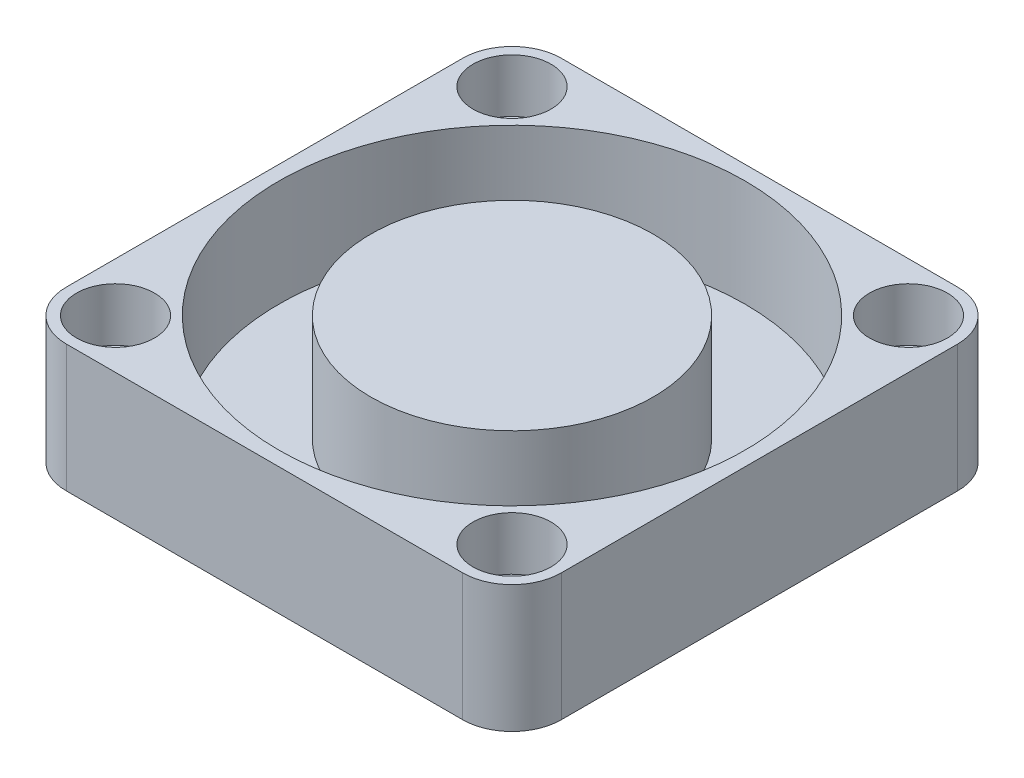
from build123d import *

# Parameters (mm, degrees)
SKETCH1_W            = 30.15
SKETCH1_H            = 30.15
BOSS_EXTRUDE1_DEPTH  = 7.75
FILLET1_R            = 3
M3_CLEARANCE_HOLE1_D = 3.2
SKETCH4_R            = 2.375
CUT_EXTRUDE1_DEPTH   = 3.25
SKETCH5_R            = 14.2
SKETCH5_R_2          = 8.6
CUT_EXTRUDE2_DEPTH   = 6.5


with BuildPart() as part:
    # Sketch1 → Boss-Extrude1 (new body)
    with BuildSketch(Plane(origin=(0, 0, 0), x_dir=(1, 0, 0), z_dir=(0, 1, 0))):
        Rectangle(SKETCH1_W, SKETCH1_H)
    extrude(amount=BOSS_EXTRUDE1_DEPTH)

    # Fillet1
    fillet1_edges = [part.edges().sort_by_distance(p)[0] for p in [
        (15.075, 3.875, 15.075),
        (-15.075, 3.875, 15.075),
        (-15.075, 3.875, -15.075),
        (15.075, 3.875, -15.075),
    ]]
    fillet(fillet1_edges, radius=FILLET1_R)

    # M3 Clearance Hole1 (through all)
    with Locations(Plane(origin=(0, 7.75, 0), x_dir=(1, 0, 0), z_dir=(0, 1, 0))):
        with Locations((-12.075, 12.075), (12.075, 12.075), (12.075, -12.075), (-12.075, -12.075)):
            Hole(M3_CLEARANCE_HOLE1_D / 2)

    # Sketch4 → Cut-Extrude1 (cut)
    with BuildSketch(Plane(origin=(0, 7.75, 0), x_dir=(1, 0, 0), z_dir=(0, 1, 0))):
        with Locations(Location((-12.075, 12.075, 0), (0, 0, 270))):
            Circle(SKETCH4_R)
        with Locations(Location((12.075, 12.075, 0), (0, 0, 270))):
            Circle(SKETCH4_R)
        with Locations(Location((-12.075, -12.075, 0), (0, 0, 270))):
            Circle(SKETCH4_R)
        with Locations(Location((12.075, -12.075, 0), (0, 0, 270))):
            Circle(SKETCH4_R)
    extrude(amount=-CUT_EXTRUDE1_DEPTH, mode=Mode.SUBTRACT)

    # Sketch5 → Cut-Extrude2 (cut)
    with BuildSketch(Plane(origin=(0, 7.75, 0), x_dir=(1, 0, 0), z_dir=(0, 1, 0))):
        with Locations(Location((0, 0, 0), (0, 0, 270))):
            Circle(SKETCH5_R)
        with Locations(Location((0, 0, 0), (0, 0, 270))):
            Circle(SKETCH5_R_2, mode=Mode.SUBTRACT)
    extrude(amount=-CUT_EXTRUDE2_DEPTH, mode=Mode.SUBTRACT)


solid = part.part
